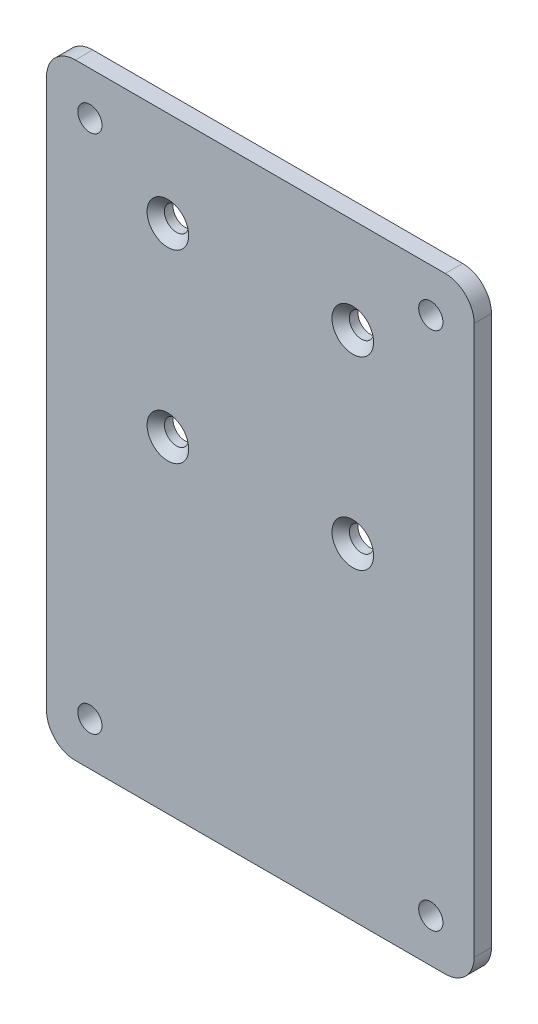
from build123d import *

# Parameters (mm, degrees)
SKETCH_1_W      = 74
SKETCH_1_H      = 105
SKETCH_1_R      = 2.1
EXTRUDE_1_DEPTH = 3
FILLET_1_R      = 5
CHAMFER_1_SIZE  = 1.5


with BuildPart() as part:
    # ｽｹｯﾁ1 → ﾎﾞｽ - 押し出し1 (new body)
    with BuildSketch(Plane.XY):
        Rectangle(SKETCH_1_W, SKETCH_1_H)
        with Locations((-16, 36)):
            Circle(SKETCH_1_R, mode=Mode.SUBTRACT)
        with Locations((16, 36)):
            Circle(SKETCH_1_R, mode=Mode.SUBTRACT)
        with Locations((-16, 4)):
            Circle(SKETCH_1_R, mode=Mode.SUBTRACT)
        with Locations((16, 4)):
            Circle(SKETCH_1_R, mode=Mode.SUBTRACT)
        with Locations((-29.5, 45)):
            Circle(SKETCH_1_R, mode=Mode.SUBTRACT)
        with Locations((-29.5, -45)):
            Circle(SKETCH_1_R, mode=Mode.SUBTRACT)
        with Locations((29.5, 45)):
            Circle(SKETCH_1_R, mode=Mode.SUBTRACT)
        with Locations((29.5, -45)):
            Circle(SKETCH_1_R, mode=Mode.SUBTRACT)
    extrude(amount=EXTRUDE_1_DEPTH)

    # ﾌｨﾚｯﾄ1
    fillet_1_edges = [part.edges().sort_by_distance(p)[0] for p in [
        (37, -52.5, 1.5),
        (-37, -52.5, 1.5),
        (-37, 52.5, 1.5),
        (37, 52.5, 1.5),
    ]]
    fillet(fillet_1_edges, radius=FILLET_1_R)

    # 面取り1
    chamfer_1_edges = [part.edges().sort_by_distance(p)[0] for p in [
        (-18.1, 36, 3),
        (13.9, 36, 3),
        (-18.1, 4, 3),
        (13.9, 4, 3),
    ]]
    chamfer(chamfer_1_edges, length=CHAMFER_1_SIZE)


solid = part.part
